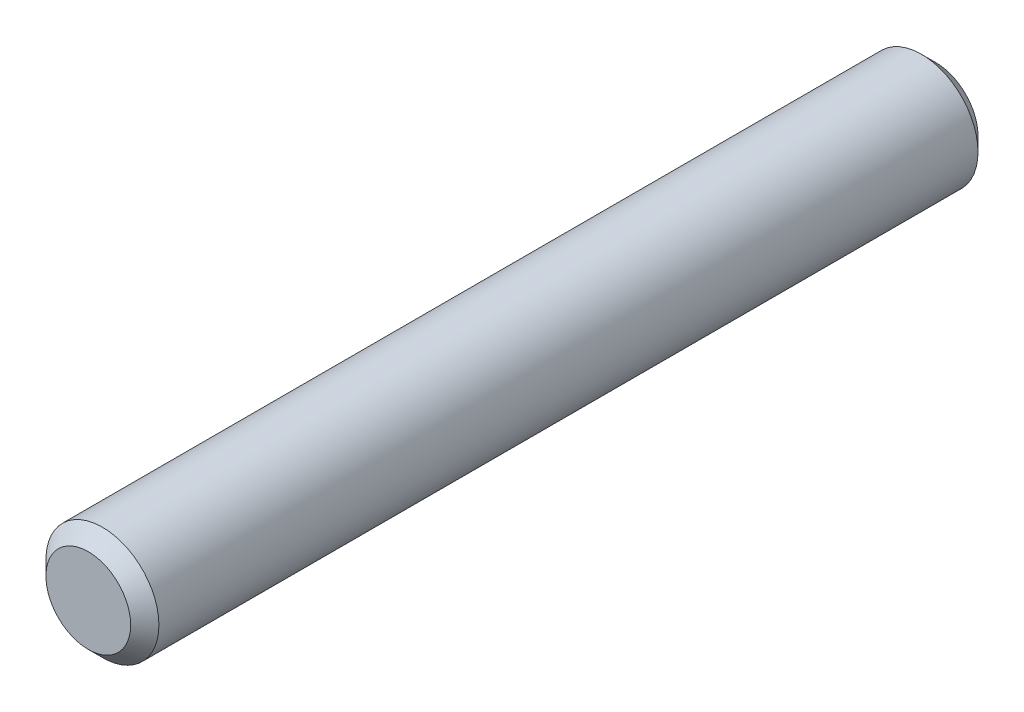
from build123d import *

# Parameters (mm, degrees)
SKETCH_1_R      = 2
EXTRUDE_1_DEPTH = 30
CHAMFER_1_SIZE  = 0.5


with BuildPart() as part:
    # 草图1 → 凸台-拉伸1 (new body)
    with BuildSketch(Plane.XY):
        Circle(SKETCH_1_R)
    extrude(amount=-EXTRUDE_1_DEPTH)

    # 倒角1
    chamfer_1_edges = [part.edges().sort_by_distance(p)[0] for p in [
        (-2, 0, 0),
        (-2, 0, -30),
    ]]
    chamfer(chamfer_1_edges, length=CHAMFER_1_SIZE)


solid = part.part
